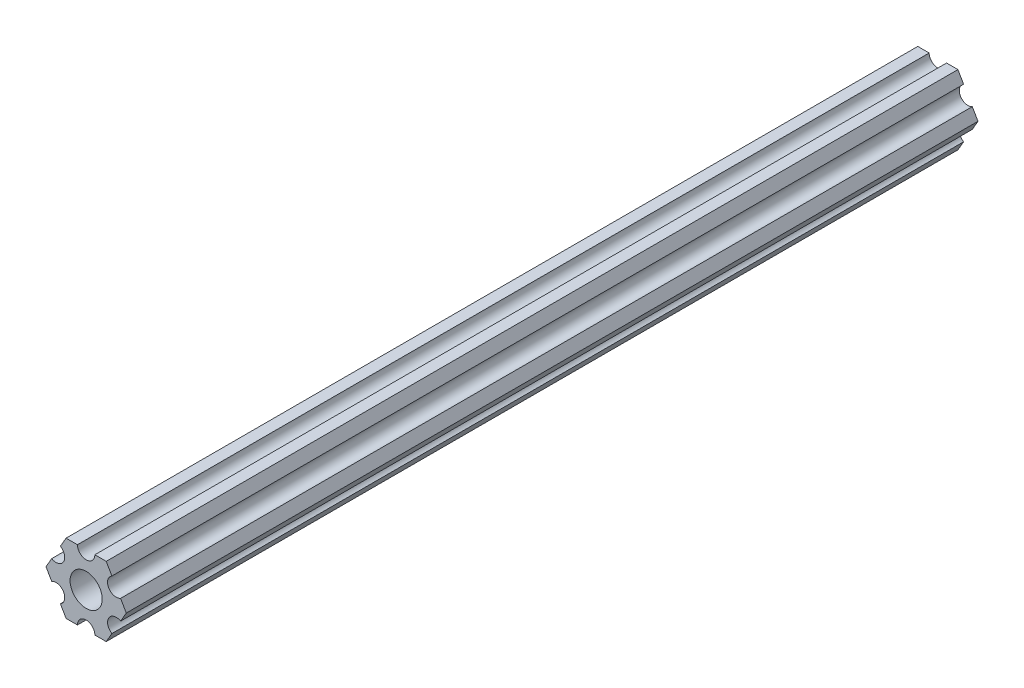
from build123d import *

# Parameters (mm, degrees)
SKETCH1_R           = 2.9337
BOSS_EXTRUDE1_DEPTH = 155.575


with BuildPart() as part:
    # Sketch1 → Boss-Extrude1 (new body)
    with BuildSketch(Plane.XY.offset(304.8)):
        with BuildLine():
            Line((6.293011699, -1.800184894), (7.332348803, -2.22e-07))
            Line((7.332348803, -2.22e-07), (6.293011439, 1.800184522))
            ThreePointArc((6.293011439, 1.800184522), (4.124446058, 2.381249653), (4.705511189, 4.549815034))
            Line((4.705511189, 4.549815034), (3.666173825, 6.349999778))
            Line((3.666173825, 6.349999778), (1.587499615, 6.349999778))
            ThreePointArc((1.587499615, 6.349999778), (-3.85e-07, 4.762499778), (-1.587500385, 6.349999778))
            Line((-1.587500385, 6.349999778), (-3.666174594, 6.349999778))
            Line((-3.666174594, 6.349999778), (-4.70551159, 4.549815043))
            ThreePointArc((-4.70551159, 4.549815043), (-4.12444613, 2.38124975), (-6.293011423, 1.80018429))
            Line((-6.293011423, 1.80018429), (-7.332348419, -4.44e-07))
            Line((-7.332348419, -4.44e-07), (-6.293011205, -1.800185053))
            ThreePointArc((-6.293011205, -1.800185053), (-4.124445841, -2.38125025), (-4.705511038, -4.549815614))
            Line((-4.705511038, -4.549815614), (-3.666173825, -6.350000222))
            Line((-3.666173825, -6.350000222), (-1.587499615, -6.350000222))
            ThreePointArc((-1.587499615, -6.350000222), (3.85e-07, -4.762500222), (1.587500385, -6.350000222))
            Line((1.587500385, -6.350000222), (3.666174594, -6.350000222))
            Line((3.666174594, -6.350000222), (4.705511699, -4.549815551))
            ThreePointArc((4.705511699, -4.549815551), (4.12444637, -2.381250222), (6.293011699, -1.800184894))
        make_face()
        with Locations(Location((0, 0, 0), (0, 0, 180))):
            Circle(SKETCH1_R, mode=Mode.SUBTRACT)
    extrude(amount=-BOSS_EXTRUDE1_DEPTH)


solid = part.part
